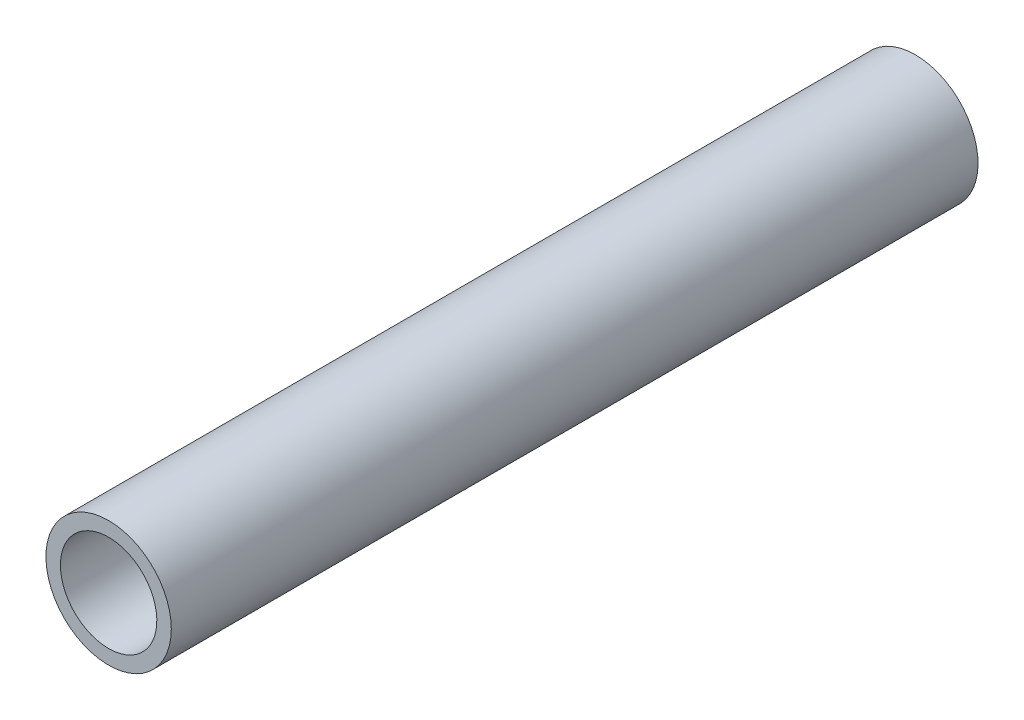
from build123d import *

# Parameters (mm, degrees)
EXTRUDE1_DEPTH                  = 19.2
EXTRUDE1_DEPTH_BACK             = 31
SKETCH1_R                       = 3.9
M6X1_0_TAPPED_HOLE1_D           = 5
M6X1_0_TAPPED_HOLE1_DEPTH       = 15
M6X1_0_TAPPED_HOLE1_CBORE_D     = 6
M6X1_0_TAPPED_HOLE1_CBORE_DEPTH = 12
M6X1_0_TAPPED_HOLE1_TIP         = 1.502151548
M6X1_0_TAPPED_HOLE2_D           = 5
M6X1_0_TAPPED_HOLE2_DEPTH       = 15
M6X1_0_TAPPED_HOLE2_CBORE_D     = 6
M6X1_0_TAPPED_HOLE2_CBORE_DEPTH = 12
M6X1_0_TAPPED_HOLE2_TIP         = 1.502151548


with BuildPart() as part:
    # Sketch1 → Extrude1 (new, two sides: drawn at the far end of the back side and taken through both)
    with BuildSketch(Plane.XY.offset(-EXTRUDE1_DEPTH_BACK)):
        with Locations(Location((95.975539476, 147.520941453, 0), (0, 0, 90))):
            Circle(SKETCH1_R)
    extrude(amount=EXTRUDE1_DEPTH + EXTRUDE1_DEPTH_BACK)

    # M6x1.0 Tapped Hole1
    with Locations(Plane(origin=(95.975539476, 147.520941453, 19.2), x_dir=(1, 0, 0), z_dir=(0, 0, 1))):
        with Locations((0, 0)):
            CounterBoreHole(M6X1_0_TAPPED_HOLE1_D / 2, M6X1_0_TAPPED_HOLE1_CBORE_D / 2, M6X1_0_TAPPED_HOLE1_CBORE_DEPTH, depth=M6X1_0_TAPPED_HOLE1_DEPTH)
            with Locations((0, 0, -(M6X1_0_TAPPED_HOLE1_DEPTH + M6X1_0_TAPPED_HOLE1_TIP / 2))):  # 118° drill point
                Cone(0, M6X1_0_TAPPED_HOLE1_D / 2, M6X1_0_TAPPED_HOLE1_TIP, mode=Mode.SUBTRACT)

    # M6x1.0 Tapped Hole2
    with Locations(Plane(origin=(95.975539476, 147.520941453, -31), x_dir=(-1, 0, 0), z_dir=(0, 0, -1))):
        with Locations((0, 0)):
            CounterBoreHole(M6X1_0_TAPPED_HOLE2_D / 2, M6X1_0_TAPPED_HOLE2_CBORE_D / 2, M6X1_0_TAPPED_HOLE2_CBORE_DEPTH, depth=M6X1_0_TAPPED_HOLE2_DEPTH)
            with Locations((0, 0, -(M6X1_0_TAPPED_HOLE2_DEPTH + M6X1_0_TAPPED_HOLE2_TIP / 2))):  # 118° drill point
                Cone(0, M6X1_0_TAPPED_HOLE2_D / 2, M6X1_0_TAPPED_HOLE2_TIP, mode=Mode.SUBTRACT)


solid = part.part
